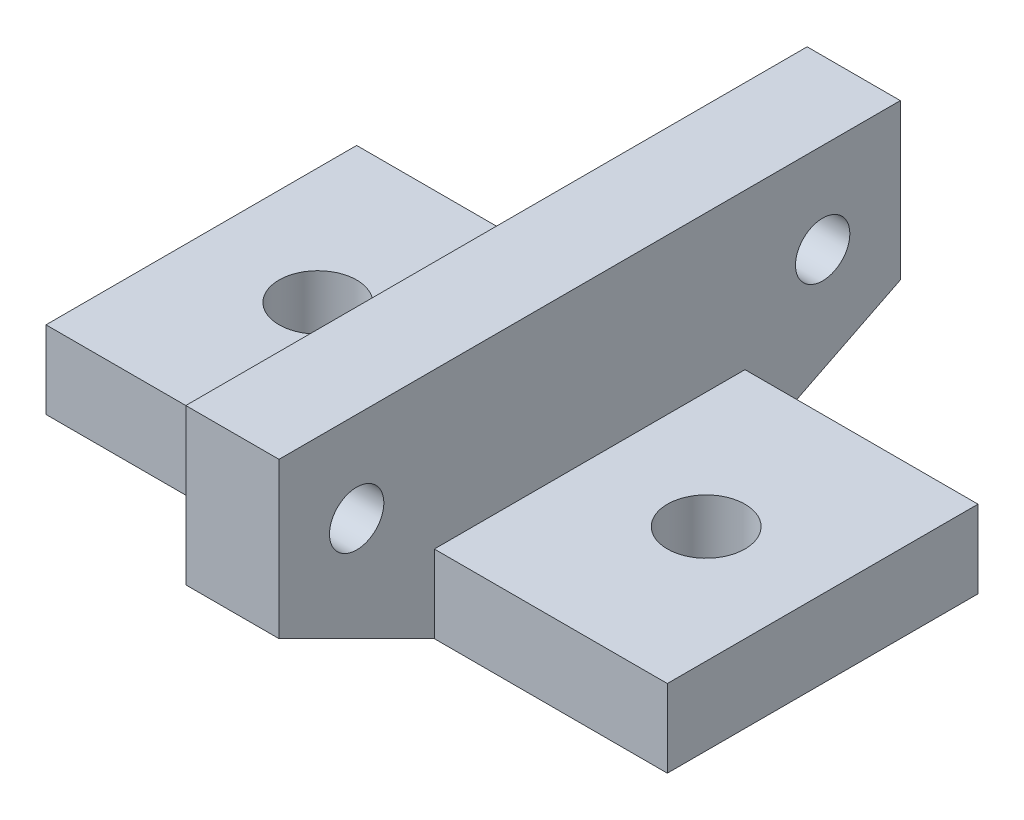
from build123d import *

# Parameters (mm, degrees)
SKETCH_1_W          = 40
SKETCH_1_H          = 20
SKETCH_1_R          = 2.5
EXTRUDE_1_DEPTH     = 5
SKETCH_2_W          = 6
SKETCH_2_H          = 40
EXTRUDE_2_DEPTH     = 10
SKETCH_3_R          = 1.75
CUT_EXTRUDE_1_DEPTH = 10
EXTRUDE_3_DEPTH     = 6


with BuildPart() as part:
    # 草图1 → 凸台-拉伸1 (new body)
    with BuildSketch(Plane(origin=(0, 0, 0), x_dir=(1, 0, 0), z_dir=(0, 1, 0))):
        Rectangle(SKETCH_1_W, SKETCH_1_H)
        with Locations(Location((-12.5, 0, 0), (0, 0, 270))):
            Circle(SKETCH_1_R, mode=Mode.SUBTRACT)
        with Locations(Location((12.5, 0, 0), (0, 0, 270))):
            Circle(SKETCH_1_R, mode=Mode.SUBTRACT)
    extrude(amount=EXTRUDE_1_DEPTH)

    # 草图2 → 凸台-拉伸2 (add)
    with BuildSketch(Plane(origin=(0, 5, 0), x_dir=(1, 0, 0), z_dir=(0, 1, 0))):
        with Locations((2, 0)):
            Rectangle(SKETCH_2_W, SKETCH_2_H)
    extrude(amount=EXTRUDE_2_DEPTH)

    # 草图3 → 切除-拉伸1 (cut)
    with BuildSketch(Plane(origin=(5, 0, 0), x_dir=(0, 0, -1), z_dir=(1, 0, 0))):
        with Locations((-15, 9.2)):
            Circle(SKETCH_3_R)
        with Locations((15, 9.2)):
            Circle(SKETCH_3_R)
    extrude(amount=-CUT_EXTRUDE_1_DEPTH, mode=Mode.SUBTRACT)

    # 草图4 → 凸台-拉伸3 (add)
    with BuildSketch(Plane(origin=(5, 0, 0), x_dir=(0, 0, -1), z_dir=(1, 0, 0))):
        Polygon((-20, 5), (-10, 0), (-10, 5), align=None)
        Polygon((10, 5), (10, 0), (20, 5), align=None)
    extrude(amount=-EXTRUDE_3_DEPTH)


solid = part.part
